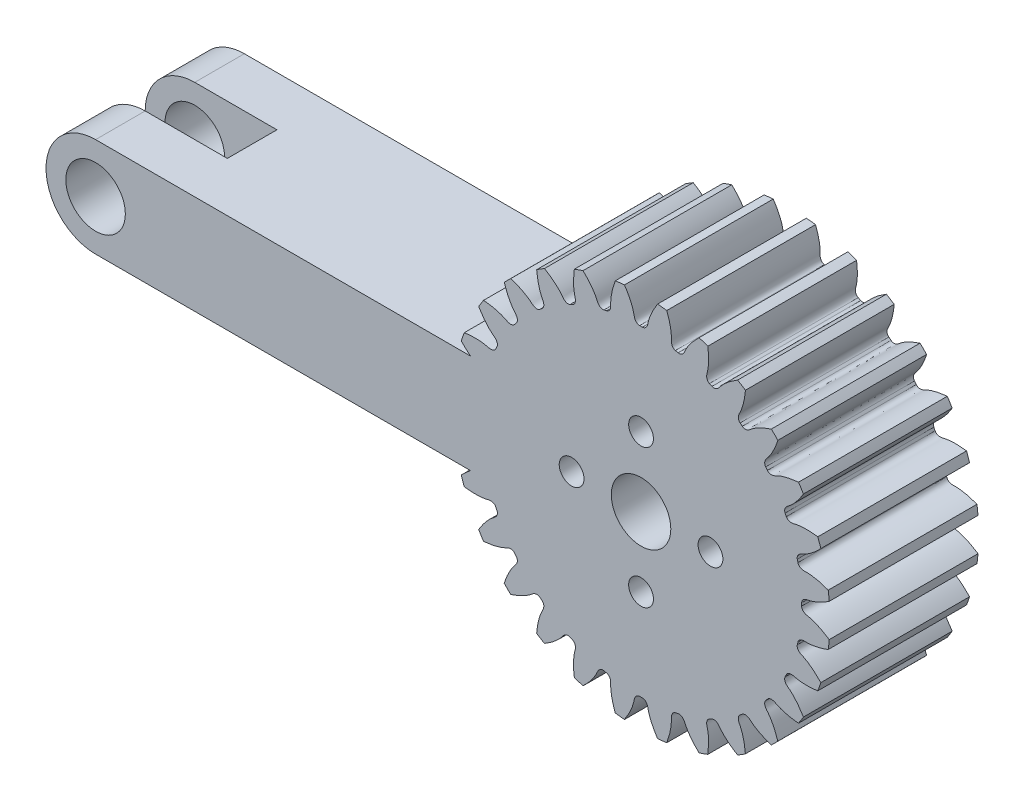
from build123d import *

# Parameters (mm, degrees)
EXTRUDE_1_DEPTH          = 5
EXTRUDE_1_DEPTH_BACK     = 10
SKETCH_1_R               = 3
CUT_EXTRUDE_2_DEPTH      = 64.718993069
CUT_EXTRUDE_2_DEPTH_BACK = 64.718993069
SKETCH_2_R               = 1.25
SKETCH_3_W               = 17.550489661
SKETCH_3_H               = 5
CUT_EXTRUDE_3_DEPTH      = 10


with BuildPart() as part:
    # 草图1 → 凸台-拉伸1 (new, two sides: drawn at the far end of the back side and taken through both)
    with BuildSketch(Plane.XY.offset(-EXTRUDE_1_DEPTH_BACK)):
        with BuildLine():
            Line((-55.000000003, -5), (-17.189672893, -5))
            add(Edge.make_bspline(
                [(-17.189672893, -5), (-17.234816242, -5.034346704), (-17.349749289, -5.124219314), (-17.536191325, -5.279824137), (-17.80860774, -5.524961859), (-18.005037889, -5.720820117), (-18.128938166, -5.851845946)],
                knots=[0.59534025, 0.59534025, 0.59534025, 0.59534025, 0.64525175, 0.723705691, 0.808981712, 0.967654618, 0.967654618, 0.967654618, 0.967654618], degree=3))
            ThreePointArc((-18.128938166, -5.851845946), (-17.980977442, -6.29181613), (-17.822340871, -6.728050674))
            add(Edge.make_bspline(
                [(-17.822340871, -6.728050674), (-17.643778466, -6.753240232), (-17.368087565, -6.783896191), (-17.002262965, -6.805703723), (-16.734795461, -6.811665992), (-16.490552385, -6.808015621), (-16.269846811, -6.796491497), (-16.072892713, -6.778846207), (-15.899810708, -6.756822422), (-15.750610886, -6.732203615), (-15.625244615, -6.706642823), (-15.533531282, -6.684564509), (-15.471344468, -6.667222726), (-15.430523644, -6.656085529), (-15.393629767, -6.647190172), (-15.33380149, -6.634339407), (-15.25072127, -6.621223819), (-15.14258995, -6.61531865), (-15.03017156, -6.623891837), (-14.908326777, -6.655267468), (-14.762390177, -6.733756345), (-14.68161261, -6.832732793), (-14.648805604, -6.899967437)],
                knots=[0.032345382, 0.032345382, 0.032345382, 0.032345382, 0.191018288, 0.276294309, 0.35474825, 0.426380109, 0.491189887, 0.549177584, 0.6003432, 0.644686735, 0.682208189, 0.712907564, 0.727668831, 0.739016053, 0.750138704, 0.761058269, 0.792860949, 0.824037898, 0.856152362, 0.891704777, 0.93402643, 1, 1, 1, 1], degree=3))
            ThreePointArc((-14.648805604, -6.899967437), (-14.588938394, -7.025662446), (-14.527992674, -7.150838071))
            add(Edge.make_bspline(
                [(-14.527992674, -7.150838071), (-14.495881346, -7.218407737), (-14.468862432, -7.343272987), (-14.498487338, -7.50630783), (-14.549925863, -7.621132303), (-14.613314795, -7.714369834), (-14.685350417, -7.795228492), (-14.747404266, -7.852005788), (-14.794753719, -7.890769098), (-14.824711346, -7.914067728), (-14.858870125, -7.939038805), (-14.911201321, -7.976845988), (-14.98564517, -8.034784756), (-15.083793993, -8.116863161), (-15.196066319, -8.218162704), (-15.321200072, -8.33975206), (-15.457794587, -8.482735315), (-15.604412185, -8.648104708), (-15.759549226, -8.836785664), (-15.921650998, -9.049617594), (-16.13268909, -9.349227556), (-16.280611762, -9.58388506), (-16.372249611, -9.739196203)],
                knots=[0, 0, 0, 0, 0.06597357, 0.108295223, 0.143847638, 0.175962102, 0.207139051, 0.238941731, 0.249861296, 0.260983947, 0.272331169, 0.287092436, 0.317791811, 0.355313265, 0.3996568, 0.450822416, 0.508810113, 0.573619891, 0.64525175, 0.723705691, 0.808981712, 0.967654618, 0.967654618, 0.967654618, 0.967654618], degree=3))
            ThreePointArc((-16.372249611, -9.739196203), (-16.130095995, -10.135211058), (-15.878365456, -10.525208332))
            add(Edge.make_bspline(
                [(-15.878365456, -10.525208332), (-15.698674779, -10.510032463), (-15.423074432, -10.478572816), (-15.061569186, -10.418429956), (-14.799480921, -10.364725619), (-14.562173813, -10.306817573), (-14.349566148, -10.246470773), (-14.161476547, -10.185441477), (-13.997634822, -10.125455505), (-13.85765395, -10.068253859), (-13.741118685, -10.01543731), (-13.656617684, -9.973504409), (-13.599848933, -9.942759553), (-13.562529832, -9.922818101), (-13.528540364, -9.905936109), (-13.473071671, -9.880094495), (-13.394992938, -9.848820654), (-13.290886721, -9.819002059), (-13.17937918, -9.802344852), (-13.053607566, -9.805820815), (-12.893864483, -9.849867864), (-12.793087847, -9.928388067), (-12.746142265, -9.986636752)],
                knots=[0.032345382, 0.032345382, 0.032345382, 0.032345382, 0.191018288, 0.276294309, 0.35474825, 0.426380109, 0.491189887, 0.549177584, 0.6003432, 0.644686735, 0.682208189, 0.712907564, 0.727668831, 0.739016053, 0.750138704, 0.761058269, 0.792860949, 0.824037898, 0.856152362, 0.891704777, 0.93402643, 1, 1, 1, 1], degree=3))
            ThreePointArc((-12.746142265, -9.986636752), (-12.65980628, -10.095858617), (-12.572534399, -10.20433413))
            add(Edge.make_bspline(
                [(-12.572534399, -10.20433413), (-12.526192505, -10.26306424), (-12.472065879, -10.378786584), (-12.464669362, -10.544325964), (-12.489267366, -10.667717697), (-12.530319703, -10.772722933), (-12.582556497, -10.867583729), (-12.63042039, -10.936745781), (-12.667957046, -10.985073457), (-12.691979139, -11.014454141), (-12.719724898, -11.046400184), (-12.762331153, -11.09490425), (-12.82201595, -11.167955686), (-12.899439814, -11.269816382), (-12.986355969, -11.393559077), (-13.081296181, -11.539944813), (-13.182649219, -11.709738319), (-13.288792655, -11.90358704), (-13.398054625, -12.122058611), (-13.508732607, -12.365625437), (-13.647810045, -12.704683946), (-13.73980778, -12.966373987), (-13.794588096, -13.138182495)],
                knots=[0, 0, 0, 0, 0.06597357, 0.108295223, 0.143847638, 0.175962102, 0.207139051, 0.238941731, 0.249861296, 0.260983947, 0.272331169, 0.287092436, 0.317791811, 0.355313265, 0.3996568, 0.450822416, 0.508810113, 0.573619891, 0.64525175, 0.723705691, 0.808981712, 0.967654618, 0.967654618, 0.967654618, 0.967654618], degree=3))
            ThreePointArc((-13.794588096, -13.138182495), (-13.470384182, -13.470384182), (-13.138182495, -13.794588096))
            add(Edge.make_bspline(
                [(-13.138182495, -13.794588096), (-12.966373987, -13.73980778), (-12.704683946, -13.647810045), (-12.365625437, -13.508732607), (-12.122058611, -13.398054625), (-11.90358704, -13.288792655), (-11.709738319, -13.182649219), (-11.539944813, -13.081296181), (-11.393559077, -12.986355969), (-11.269816382, -12.899439814), (-11.167955686, -12.82201595), (-11.09490425, -12.762331153), (-11.046400184, -12.719724898), (-11.014454141, -12.691979139), (-10.985073458, -12.667957046), (-10.936745781, -12.63042039), (-10.867583729, -12.582556497), (-10.772722933, -12.530319703), (-10.667717697, -12.489267366), (-10.544325964, -12.464669362), (-10.378786584, -12.472065879), (-10.26306424, -12.526192505), (-10.20433413, -12.572534399)],
                knots=[0.032345382, 0.032345382, 0.032345382, 0.032345382, 0.191018288, 0.276294309, 0.35474825, 0.426380109, 0.491189887, 0.549177584, 0.6003432, 0.644686735, 0.682208189, 0.712907564, 0.727668831, 0.739016053, 0.750138704, 0.761058269, 0.792860949, 0.824037898, 0.856152362, 0.891704777, 0.93402643, 1, 1, 1, 1], degree=3))
            ThreePointArc((-10.20433413, -12.572534399), (-10.095858617, -12.65980628), (-9.986636752, -12.746142265))
            add(Edge.make_bspline(
                [(-9.986636752, -12.746142265), (-9.928388067, -12.793087847), (-9.849867864, -12.893864483), (-9.805820815, -13.053607566), (-9.802344852, -13.17937918), (-9.819002059, -13.290886721), (-9.848820654, -13.394992938), (-9.880094495, -13.473071671), (-9.905936109, -13.528540364), (-9.922818101, -13.562529831), (-9.942759553, -13.599848933), (-9.973504409, -13.656617684), (-10.01543731, -13.741118685), (-10.068253859, -13.85765395), (-10.125455505, -13.997634822), (-10.185441477, -14.161476547), (-10.246470773, -14.349566148), (-10.306817573, -14.562173813), (-10.364725619, -14.799480921), (-10.418429956, -15.061569186), (-10.478572816, -15.423074432), (-10.510032463, -15.698674779), (-10.525208332, -15.878365456)],
                knots=[0, 0, 0, 0, 0.06597357, 0.108295223, 0.143847638, 0.175962102, 0.207139051, 0.238941731, 0.249861296, 0.260983947, 0.272331169, 0.287092436, 0.317791811, 0.355313265, 0.3996568, 0.450822416, 0.508810113, 0.573619891, 0.64525175, 0.723705691, 0.808981712, 0.967654618, 0.967654618, 0.967654618, 0.967654618], degree=3))
            ThreePointArc((-10.525208332, -15.878365456), (-10.135211058, -16.130095995), (-9.739196203, -16.372249611))
            add(Edge.make_bspline(
                [(-9.739196203, -16.372249611), (-9.58388506, -16.280611762), (-9.349227556, -16.13268909), (-9.049617594, -15.921650998), (-8.836785664, -15.759549226), (-8.648104708, -15.604412185), (-8.482735315, -15.457794587), (-8.33975206, -15.321200072), (-8.218162704, -15.196066319), (-8.116863161, -15.083793993), (-8.034784756, -14.98564517), (-7.976845988, -14.911201321), (-7.939038805, -14.858870125), (-7.914067728, -14.824711346), (-7.890769098, -14.794753719), (-7.852005788, -14.747404266), (-7.795228492, -14.685350417), (-7.714369834, -14.613314795), (-7.621132303, -14.549925862), (-7.50630783, -14.498487338), (-7.343272987, -14.468862432), (-7.218407737, -14.495881346), (-7.150838072, -14.527992674)],
                knots=[0.032345382, 0.032345382, 0.032345382, 0.032345382, 0.191018288, 0.276294309, 0.35474825, 0.426380109, 0.491189887, 0.549177584, 0.6003432, 0.644686735, 0.682208189, 0.712907564, 0.727668831, 0.739016053, 0.750138704, 0.761058269, 0.792860949, 0.824037898, 0.856152362, 0.891704777, 0.93402643, 1, 1, 1, 1], degree=3))
            ThreePointArc((-7.150838072, -14.527992674), (-7.025662446, -14.588938394), (-6.899967437, -14.648805604))
            add(Edge.make_bspline(
                [(-6.899967437, -14.648805604), (-6.832732793, -14.68161261), (-6.733756345, -14.762390177), (-6.655267468, -14.908326777), (-6.623891837, -15.03017156), (-6.61531865, -15.14258995), (-6.621223819, -15.25072127), (-6.634339407, -15.33380149), (-6.647190172, -15.393629767), (-6.656085529, -15.430523644), (-6.667222726, -15.471344468), (-6.684564509, -15.533531282), (-6.706642823, -15.625244615), (-6.732203615, -15.750610886), (-6.756822422, -15.899810708), (-6.778846207, -16.072892713), (-6.796491497, -16.269846811), (-6.808015621, -16.490552385), (-6.811665992, -16.734795461), (-6.805703723, -17.002262965), (-6.783896191, -17.368087565), (-6.753240232, -17.643778466), (-6.728050674, -17.822340871)],
                knots=[0, 0, 0, 0, 0.06597357, 0.108295223, 0.143847638, 0.175962102, 0.207139051, 0.238941731, 0.249861296, 0.260983947, 0.272331169, 0.287092436, 0.317791811, 0.355313265, 0.3996568, 0.450822416, 0.508810113, 0.573619891, 0.64525175, 0.723705691, 0.808981712, 0.967654618, 0.967654618, 0.967654618, 0.967654618], degree=3))
            ThreePointArc((-6.728050674, -17.822340871), (-6.29181613, -17.980977442), (-5.851845946, -18.128938166))
            add(Edge.make_bspline(
                [(-5.851845946, -18.128938166), (-5.720820117, -18.005037889), (-5.524961859, -17.80860774), (-5.279824137, -17.536191325), (-5.108399385, -17.330794223), (-4.958970294, -17.137561328), (-4.830372542, -16.957821588), (-4.721369314, -16.792835016), (-4.630673337, -16.64378245), (-4.556896528, -16.511783756), (-4.498716168, -16.397831566), (-4.458795361, -16.312361591), (-4.433580869, -16.252929557), (-4.416836913, -16.214070623), (-4.400788627, -16.179679664), (-4.373533439, -16.124891713), (-4.331987949, -16.051759546), (-4.26918602, -15.963537264), (-4.192391513, -15.880990321), (-4.091892077, -15.80529062), (-3.93953702, -15.740129806), (-3.811790128, -15.738686168), (-3.738769133, -15.754956732)],
                knots=[0.032345382, 0.032345382, 0.032345382, 0.032345382, 0.191018288, 0.276294309, 0.35474825, 0.426380109, 0.491189887, 0.549177584, 0.6003432, 0.644686735, 0.682208189, 0.712907564, 0.727668831, 0.739016053, 0.750138704, 0.761058269, 0.792860949, 0.824037898, 0.856152362, 0.891704777, 0.93402643, 1, 1, 1, 1], degree=3))
            ThreePointArc((-3.738769133, -15.754956732), (-3.603170223, -15.786520218), (-3.467304943, -15.816916662))
            add(Edge.make_bspline(
                [(-3.467304943, -15.816916662), (-3.394455767, -15.833940012), (-3.279986165, -15.890667985), (-3.170991219, -16.015480231), (-3.113289227, -16.127288376), (-3.079915542, -16.23498049), (-3.061611173, -16.341714755), (-3.055910838, -16.425630473), (-3.055126363, -16.486818295), (-3.055589036, -16.524766568), (-3.057363512, -16.567042188), (-3.060432633, -16.631528759), (-3.06154926, -16.725855534), (-3.05857257, -16.853766422), (-3.049374048, -17.004703694), (-3.032331281, -17.178346925), (-3.005707757, -17.374289419), (-2.967831337, -17.592025802), (-2.917040988, -17.830957477), (-2.851711087, -18.090392283), (-2.749046684, -18.442192264), (-2.657812337, -18.704149427), (-2.59352046, -18.872629695)],
                knots=[0, 0, 0, 0, 0.06597357, 0.108295223, 0.143847638, 0.175962102, 0.207139051, 0.238941731, 0.249861296, 0.260983947, 0.272331169, 0.287092436, 0.317791811, 0.355313265, 0.3996568, 0.450822416, 0.508810113, 0.573619891, 0.64525175, 0.723705691, 0.808981712, 0.967654618, 0.967654618, 0.967654618, 0.967654618], degree=3))
            ThreePointArc((-2.59352046, -18.872629695), (-2.13292327, -18.930217598), (-1.671059698, -18.976566061))
            add(Edge.make_bspline(
                [(-1.671059698, -18.976566061), (-1.570889366, -18.826616233), (-1.423651503, -18.591528436), (-1.245278251, -18.271393794), (-1.123856631, -18.033000831), (-1.021172403, -17.811361587), (-0.93579472, -17.607512606), (-0.866237397, -17.422407091), (-0.810982674, -17.25690983), (-0.768428075, -17.111803735), (-0.737063166, -16.987762216), (-0.717162116, -16.895551937), (-0.705804675, -16.831999236), (-0.698127451, -16.790388696), (-0.690134238, -16.75328891), (-0.675753861, -16.693809757), (-0.651523441, -16.613266425), (-0.609927392, -16.513281316), (-0.553426706, -16.415715612), (-0.47229177, -16.319550632), (-0.338256217, -16.222121346), (-0.214033446, -16.192287545), (-0.139222699, -16.191901472)],
                knots=[0.032345382, 0.032345382, 0.032345382, 0.032345382, 0.191018288, 0.276294309, 0.35474825, 0.426380109, 0.491189887, 0.549177584, 0.6003432, 0.644686735, 0.682208189, 0.712907564, 0.727668831, 0.739016053, 0.750138704, 0.761058269, 0.792860949, 0.824037898, 0.856152362, 0.891704777, 0.93402643, 1, 1, 1, 1], degree=3))
            ThreePointArc((-0.139222699, -16.191901472), (0, -16.1925), (0.139222699, -16.191901472))
            add(Edge.make_bspline(
                [(0.139222699, -16.191901472), (0.214033446, -16.192287545), (0.338256217, -16.222121346), (0.47229177, -16.319550632), (0.553426706, -16.415715612), (0.609927392, -16.513281316), (0.651523441, -16.613266425), (0.675753861, -16.693809757), (0.690134238, -16.75328891), (0.698127451, -16.790388696), (0.705804675, -16.831999236), (0.717162116, -16.895551937), (0.737063166, -16.987762216), (0.768428075, -17.111803735), (0.810982673, -17.25690983), (0.866237396, -17.422407091), (0.93579472, -17.607512606), (1.021172403, -17.811361587), (1.123856631, -18.033000831), (1.24527825, -18.271393794), (1.423651503, -18.591528436), (1.570889366, -18.826616233), (1.671059698, -18.976566061)],
                knots=[0, 0, 0, 0, 0.06597357, 0.108295223, 0.143847638, 0.175962102, 0.207139051, 0.238941731, 0.249861296, 0.260983947, 0.272331169, 0.287092436, 0.317791811, 0.355313265, 0.3996568, 0.450822416, 0.508810113, 0.573619891, 0.64525175, 0.723705691, 0.808981712, 0.967654618, 0.967654618, 0.967654618, 0.967654618], degree=3))
            ThreePointArc((1.671059698, -18.976566061), (2.13292327, -18.930217598), (2.59352046, -18.872629695))
            add(Edge.make_bspline(
                [(2.59352046, -18.872629695), (2.657812337, -18.704149427), (2.749046684, -18.442192264), (2.851711087, -18.090392283), (2.917040988, -17.830957477), (2.967831337, -17.592025802), (3.005707757, -17.374289419), (3.032331281, -17.178346925), (3.049374048, -17.004703694), (3.05857257, -16.853766422), (3.06154926, -16.725855534), (3.060432632, -16.631528759), (3.057363512, -16.567042188), (3.055589035, -16.524766568), (3.055126363, -16.486818295), (3.055910838, -16.425630473), (3.061611173, -16.341714755), (3.079915542, -16.23498049), (3.113289227, -16.127288376), (3.170991219, -16.015480231), (3.279986165, -15.890667985), (3.394455767, -15.833940012), (3.467304943, -15.816916662)],
                knots=[0.032345382, 0.032345382, 0.032345382, 0.032345382, 0.191018288, 0.276294309, 0.35474825, 0.426380109, 0.491189887, 0.549177584, 0.6003432, 0.644686735, 0.682208189, 0.712907564, 0.727668831, 0.739016053, 0.750138704, 0.761058269, 0.792860949, 0.824037898, 0.856152362, 0.891704777, 0.93402643, 1, 1, 1, 1], degree=3))
            ThreePointArc((3.467304943, -15.816916662), (3.603170223, -15.786520218), (3.738769133, -15.754956732))
            add(Edge.make_bspline(
                [(3.738769133, -15.754956732), (3.811790128, -15.738686168), (3.93953702, -15.740129806), (4.091892077, -15.80529062), (4.192391513, -15.880990321), (4.26918602, -15.963537264), (4.331987949, -16.051759546), (4.373533439, -16.124891713), (4.400788627, -16.179679664), (4.416836913, -16.214070623), (4.433580869, -16.252929557), (4.458795361, -16.312361591), (4.498716168, -16.397831566), (4.556896528, -16.511783756), (4.630673337, -16.64378245), (4.721369314, -16.792835016), (4.830372542, -16.957821588), (4.958970294, -17.137561328), (5.108399385, -17.330794223), (5.279824137, -17.536191325), (5.524961859, -17.80860774), (5.720820117, -18.005037889), (5.851845946, -18.128938166)],
                knots=[0, 0, 0, 0, 0.06597357, 0.108295223, 0.143847638, 0.175962102, 0.207139051, 0.238941731, 0.249861296, 0.260983947, 0.272331169, 0.287092436, 0.317791811, 0.355313265, 0.3996568, 0.450822416, 0.508810113, 0.573619891, 0.64525175, 0.723705691, 0.808981712, 0.967654618, 0.967654618, 0.967654618, 0.967654618], degree=3))
            ThreePointArc((5.851845946, -18.128938166), (6.29181613, -17.980977442), (6.728050674, -17.822340871))
            add(Edge.make_bspline(
                [(6.728050674, -17.822340871), (6.753240232, -17.643778466), (6.783896191, -17.368087565), (6.805703723, -17.002262965), (6.811665992, -16.734795461), (6.808015621, -16.490552385), (6.796491497, -16.269846811), (6.778846207, -16.072892713), (6.756822422, -15.899810708), (6.732203615, -15.750610886), (6.706642823, -15.625244615), (6.684564509, -15.533531282), (6.667222726, -15.471344468), (6.656085529, -15.430523644), (6.647190172, -15.393629767), (6.634339407, -15.33380149), (6.621223819, -15.25072127), (6.61531865, -15.14258995), (6.623891837, -15.03017156), (6.655267468, -14.908326777), (6.733756345, -14.762390177), (6.832732793, -14.68161261), (6.899967437, -14.648805604)],
                knots=[0.032345382, 0.032345382, 0.032345382, 0.032345382, 0.191018288, 0.276294309, 0.35474825, 0.426380109, 0.491189887, 0.549177584, 0.6003432, 0.644686735, 0.682208189, 0.712907564, 0.727668831, 0.739016053, 0.750138704, 0.761058269, 0.792860949, 0.824037898, 0.856152362, 0.891704777, 0.93402643, 1, 1, 1, 1], degree=3))
            ThreePointArc((6.899967437, -14.648805604), (7.025662446, -14.588938394), (7.150838071, -14.527992674))
            add(Edge.make_bspline(
                [(7.150838071, -14.527992674), (7.218407737, -14.495881346), (7.343272987, -14.468862432), (7.50630783, -14.498487338), (7.621132303, -14.549925862), (7.714369834, -14.613314795), (7.795228492, -14.685350417), (7.852005788, -14.747404266), (7.890769098, -14.794753719), (7.914067728, -14.824711346), (7.939038804, -14.858870125), (7.976845988, -14.911201321), (8.034784756, -14.98564517), (8.116863161, -15.083793993), (8.218162704, -15.196066319), (8.33975206, -15.321200072), (8.482735315, -15.457794587), (8.648104708, -15.604412185), (8.836785664, -15.759549226), (9.049617594, -15.921650998), (9.349227556, -16.13268909), (9.58388506, -16.280611762), (9.739196203, -16.372249611)],
                knots=[0, 0, 0, 0, 0.06597357, 0.108295223, 0.143847638, 0.175962102, 0.207139051, 0.238941731, 0.249861296, 0.260983947, 0.272331169, 0.287092436, 0.317791811, 0.355313265, 0.3996568, 0.450822416, 0.508810113, 0.573619891, 0.64525175, 0.723705691, 0.808981712, 0.967654618, 0.967654618, 0.967654618, 0.967654618], degree=3))
            ThreePointArc((9.739196203, -16.372249611), (10.135211058, -16.130095995), (10.525208332, -15.878365456))
            add(Edge.make_bspline(
                [(10.525208332, -15.878365456), (10.510032463, -15.698674779), (10.478572816, -15.423074432), (10.418429956, -15.061569186), (10.364725619, -14.799480921), (10.306817573, -14.562173813), (10.246470773, -14.349566148), (10.185441477, -14.161476547), (10.125455505, -13.997634822), (10.068253859, -13.85765395), (10.01543731, -13.741118685), (9.973504409, -13.656617684), (9.942759553, -13.599848933), (9.922818101, -13.562529831), (9.905936109, -13.528540364), (9.880094495, -13.473071671), (9.848820654, -13.394992938), (9.819002059, -13.290886721), (9.802344852, -13.17937918), (9.805820815, -13.053607566), (9.849867864, -12.893864483), (9.928388067, -12.793087847), (9.986636752, -12.746142265)],
                knots=[0.032345382, 0.032345382, 0.032345382, 0.032345382, 0.191018288, 0.276294309, 0.35474825, 0.426380109, 0.491189887, 0.549177584, 0.6003432, 0.644686735, 0.682208189, 0.712907564, 0.727668831, 0.739016053, 0.750138704, 0.761058269, 0.792860949, 0.824037898, 0.856152362, 0.891704777, 0.93402643, 1, 1, 1, 1], degree=3))
            ThreePointArc((9.986636752, -12.746142265), (10.095858617, -12.65980628), (10.20433413, -12.572534399))
            add(Edge.make_bspline(
                [(10.20433413, -12.572534399), (10.26306424, -12.526192505), (10.378786583, -12.472065879), (10.544325964, -12.464669362), (10.667717696, -12.489267366), (10.772722933, -12.530319703), (10.867583729, -12.582556497), (10.936745781, -12.63042039), (10.985073457, -12.667957046), (11.014454141, -12.691979139), (11.046400184, -12.719724898), (11.09490425, -12.762331153), (11.167955686, -12.82201595), (11.269816382, -12.899439814), (11.393559077, -12.986355969), (11.539944813, -13.081296181), (11.709738319, -13.182649219), (11.90358704, -13.288792655), (12.122058611, -13.398054625), (12.365625437, -13.508732607), (12.704683946, -13.647810045), (12.966373987, -13.73980778), (13.138182495, -13.794588096)],
                knots=[0, 0, 0, 0, 0.06597357, 0.108295223, 0.143847638, 0.175962102, 0.207139051, 0.238941731, 0.249861296, 0.260983947, 0.272331169, 0.287092436, 0.317791811, 0.355313265, 0.3996568, 0.450822416, 0.508810113, 0.573619891, 0.64525175, 0.723705691, 0.808981712, 0.967654618, 0.967654618, 0.967654618, 0.967654618], degree=3))
            ThreePointArc((13.138182495, -13.794588096), (13.470384182, -13.470384182), (13.794588096, -13.138182495))
            add(Edge.make_bspline(
                [(13.794588096, -13.138182495), (13.73980778, -12.966373987), (13.647810045, -12.704683946), (13.508732607, -12.365625437), (13.398054625, -12.122058611), (13.288792655, -11.90358704), (13.182649219, -11.709738319), (13.081296181, -11.539944813), (12.986355969, -11.393559077), (12.899439814, -11.269816382), (12.82201595, -11.167955686), (12.762331153, -11.09490425), (12.719724898, -11.046400184), (12.691979139, -11.014454141), (12.667957046, -10.985073457), (12.63042039, -10.936745781), (12.582556497, -10.867583729), (12.530319703, -10.772722933), (12.489267366, -10.667717697), (12.464669362, -10.544325964), (12.472065879, -10.378786584), (12.526192505, -10.26306424), (12.572534399, -10.20433413)],
                knots=[0.032345382, 0.032345382, 0.032345382, 0.032345382, 0.191018288, 0.276294309, 0.35474825, 0.426380109, 0.491189887, 0.549177584, 0.6003432, 0.644686735, 0.682208189, 0.712907564, 0.727668831, 0.739016053, 0.750138704, 0.761058269, 0.792860949, 0.824037898, 0.856152362, 0.891704777, 0.93402643, 1, 1, 1, 1], degree=3))
            ThreePointArc((12.572534399, -10.20433413), (12.65980628, -10.095858617), (12.746142265, -9.986636752))
            add(Edge.make_bspline(
                [(12.746142265, -9.986636752), (12.793087847, -9.928388067), (12.893864483, -9.849867864), (13.053607566, -9.805820815), (13.17937918, -9.802344852), (13.29088672, -9.819002059), (13.394992938, -9.848820654), (13.473071671, -9.880094495), (13.528540364, -9.905936109), (13.562529831, -9.922818101), (13.599848933, -9.942759553), (13.656617683, -9.973504409), (13.741118685, -10.01543731), (13.85765395, -10.068253859), (13.997634822, -10.125455505), (14.161476547, -10.185441477), (14.349566148, -10.246470773), (14.562173813, -10.306817573), (14.799480921, -10.364725619), (15.061569186, -10.418429956), (15.423074432, -10.478572816), (15.698674779, -10.510032463), (15.878365456, -10.525208332)],
                knots=[0, 0, 0, 0, 0.06597357, 0.108295223, 0.143847638, 0.175962102, 0.207139051, 0.238941731, 0.249861296, 0.260983947, 0.272331169, 0.287092436, 0.317791811, 0.355313265, 0.3996568, 0.450822416, 0.508810113, 0.573619891, 0.64525175, 0.723705691, 0.808981712, 0.967654618, 0.967654618, 0.967654618, 0.967654618], degree=3))
            ThreePointArc((15.878365456, -10.525208332), (16.130095995, -10.135211058), (16.372249611, -9.739196203))
            add(Edge.make_bspline(
                [(16.372249611, -9.739196203), (16.280611762, -9.58388506), (16.13268909, -9.349227556), (15.921650998, -9.049617594), (15.759549226, -8.836785664), (15.604412185, -8.648104708), (15.457794587, -8.482735315), (15.321200072, -8.33975206), (15.196066319, -8.218162704), (15.083793993, -8.116863161), (14.98564517, -8.034784756), (14.911201321, -7.976845988), (14.858870125, -7.939038805), (14.824711346, -7.914067728), (14.794753719, -7.890769098), (14.747404266, -7.852005788), (14.685350417, -7.795228492), (14.613314795, -7.714369834), (14.549925862, -7.621132303), (14.498487338, -7.50630783), (14.468862432, -7.343272987), (14.495881346, -7.218407737), (14.527992674, -7.150838072)],
                knots=[0.032345382, 0.032345382, 0.032345382, 0.032345382, 0.191018288, 0.276294309, 0.35474825, 0.426380109, 0.491189887, 0.549177584, 0.6003432, 0.644686735, 0.682208189, 0.712907564, 0.727668831, 0.739016053, 0.750138704, 0.761058269, 0.792860949, 0.824037898, 0.856152362, 0.891704777, 0.93402643, 1, 1, 1, 1], degree=3))
            ThreePointArc((14.527992674, -7.150838072), (14.588938393, -7.025662446), (14.648805604, -6.899967437))
            add(Edge.make_bspline(
                [(14.648805604, -6.899967437), (14.68161261, -6.832732793), (14.762390177, -6.733756345), (14.908326777, -6.655267468), (15.03017156, -6.623891837), (15.14258995, -6.61531865), (15.25072127, -6.621223819), (15.33380149, -6.634339407), (15.393629767, -6.647190172), (15.430523644, -6.656085529), (15.471344468, -6.667222726), (15.533531282, -6.684564509), (15.625244615, -6.706642823), (15.750610886, -6.732203615), (15.899810708, -6.756822422), (16.072892713, -6.778846207), (16.269846811, -6.796491497), (16.490552385, -6.808015621), (16.734795461, -6.811665992), (17.002262965, -6.805703723), (17.368087565, -6.783896191), (17.643778466, -6.753240232), (17.822340871, -6.728050674)],
                knots=[0, 0, 0, 0, 0.06597357, 0.108295223, 0.143847638, 0.175962102, 0.207139051, 0.238941731, 0.249861296, 0.260983947, 0.272331169, 0.287092436, 0.317791811, 0.355313265, 0.3996568, 0.450822416, 0.508810113, 0.573619891, 0.64525175, 0.723705691, 0.808981712, 0.967654618, 0.967654618, 0.967654618, 0.967654618], degree=3))
            ThreePointArc((17.822340871, -6.728050674), (17.980977442, -6.29181613), (18.128938166, -5.851845946))
            add(Edge.make_bspline(
                [(18.128938166, -5.851845946), (18.005037889, -5.720820117), (17.80860774, -5.524961859), (17.536191325, -5.279824137), (17.330794223, -5.108399385), (17.137561328, -4.958970294), (16.957821588, -4.830372542), (16.792835016, -4.721369314), (16.64378245, -4.630673337), (16.511783756, -4.556896528), (16.397831566, -4.498716168), (16.312361591, -4.458795361), (16.252929557, -4.433580869), (16.214070623, -4.416836913), (16.179679664, -4.400788627), (16.124891713, -4.373533439), (16.051759546, -4.331987949), (15.963537264, -4.26918602), (15.880990321, -4.192391513), (15.80529062, -4.091892077), (15.740129806, -3.93953702), (15.738686168, -3.811790128), (15.754956732, -3.738769133)],
                knots=[0.032345382, 0.032345382, 0.032345382, 0.032345382, 0.191018288, 0.276294309, 0.35474825, 0.426380109, 0.491189887, 0.549177584, 0.6003432, 0.644686735, 0.682208189, 0.712907564, 0.727668831, 0.739016053, 0.750138704, 0.761058269, 0.792860949, 0.824037898, 0.856152362, 0.891704777, 0.93402643, 1, 1, 1, 1], degree=3))
            ThreePointArc((15.754956732, -3.738769133), (15.786520218, -3.603170223), (15.816916662, -3.467304943))
            add(Edge.make_bspline(
                [(15.816916662, -3.467304943), (15.833940012, -3.394455767), (15.890667985, -3.279986165), (16.015480231, -3.170991219), (16.127288376, -3.113289227), (16.23498049, -3.079915542), (16.341714755, -3.061611173), (16.425630473, -3.055910838), (16.486818295, -3.055126363), (16.524766568, -3.055589036), (16.567042188, -3.057363512), (16.631528759, -3.060432632), (16.725855534, -3.06154926), (16.853766422, -3.05857257), (17.004703694, -3.049374048), (17.178346925, -3.032331281), (17.374289419, -3.005707757), (17.592025802, -2.967831337), (17.830957477, -2.917040988), (18.090392283, -2.851711087), (18.442192264, -2.749046684), (18.704149427, -2.657812337), (18.872629695, -2.59352046)],
                knots=[0, 0, 0, 0, 0.06597357, 0.108295223, 0.143847638, 0.175962102, 0.207139051, 0.238941731, 0.249861296, 0.260983947, 0.272331169, 0.287092436, 0.317791811, 0.355313265, 0.3996568, 0.450822416, 0.508810113, 0.573619891, 0.64525175, 0.723705691, 0.808981712, 0.967654618, 0.967654618, 0.967654618, 0.967654618], degree=3))
            ThreePointArc((18.872629695, -2.59352046), (18.930217598, -2.13292327), (18.976566061, -1.671059698))
            add(Edge.make_bspline(
                [(18.976566061, -1.671059698), (18.826616233, -1.570889366), (18.591528436, -1.423651503), (18.271393794, -1.245278251), (18.033000831, -1.123856631), (17.811361587, -1.021172403), (17.607512606, -0.93579472), (17.422407091, -0.866237396), (17.25690983, -0.810982673), (17.111803735, -0.768428075), (16.987762216, -0.737063166), (16.895551937, -0.717162116), (16.831999236, -0.705804675), (16.790388696, -0.698127451), (16.75328891, -0.690134238), (16.693809757, -0.675753861), (16.613266425, -0.651523441), (16.513281316, -0.609927392), (16.415715612, -0.553426706), (16.319550632, -0.47229177), (16.222121346, -0.338256217), (16.192287545, -0.214033446), (16.191901472, -0.139222699)],
                knots=[0.032345382, 0.032345382, 0.032345382, 0.032345382, 0.191018288, 0.276294309, 0.35474825, 0.426380109, 0.491189887, 0.549177584, 0.6003432, 0.644686735, 0.682208189, 0.712907564, 0.727668831, 0.739016053, 0.750138704, 0.761058269, 0.792860949, 0.824037898, 0.856152362, 0.891704777, 0.93402643, 1, 1, 1, 1], degree=3))
            ThreePointArc((16.191901472, -0.139222699), (16.1925, 0), (16.191901472, 0.139222699))
            add(Edge.make_bspline(
                [(16.191901472, 0.139222699), (16.192287545, 0.214033446), (16.222121346, 0.338256217), (16.319550632, 0.47229177), (16.415715612, 0.553426706), (16.513281316, 0.609927392), (16.613266425, 0.651523441), (16.693809757, 0.675753861), (16.75328891, 0.690134238), (16.790388696, 0.698127451), (16.831999236, 0.705804675), (16.895551937, 0.717162116), (16.987762216, 0.737063166), (17.111803735, 0.768428075), (17.25690983, 0.810982673), (17.422407091, 0.866237396), (17.607512606, 0.93579472), (17.811361587, 1.021172403), (18.033000831, 1.123856631), (18.271393794, 1.245278251), (18.591528436, 1.423651503), (18.826616233, 1.570889366), (18.976566061, 1.671059698)],
                knots=[0, 0, 0, 0, 0.06597357, 0.108295223, 0.143847638, 0.175962102, 0.207139051, 0.238941731, 0.249861296, 0.260983947, 0.272331169, 0.287092436, 0.317791811, 0.355313265, 0.3996568, 0.450822416, 0.508810113, 0.573619891, 0.64525175, 0.723705691, 0.808981712, 0.967654618, 0.967654618, 0.967654618, 0.967654618], degree=3))
            ThreePointArc((18.976566061, 1.671059698), (18.930217598, 2.13292327), (18.872629695, 2.59352046))
            add(Edge.make_bspline(
                [(18.872629695, 2.59352046), (18.704149427, 2.657812337), (18.442192264, 2.749046684), (18.090392283, 2.851711087), (17.830957477, 2.917040988), (17.592025802, 2.967831337), (17.374289419, 3.005707757), (17.178346925, 3.032331281), (17.004703694, 3.049374048), (16.853766422, 3.05857257), (16.725855534, 3.06154926), (16.631528759, 3.060432632), (16.567042188, 3.057363512), (16.524766568, 3.055589036), (16.486818295, 3.055126363), (16.425630473, 3.055910838), (16.341714755, 3.061611173), (16.23498049, 3.079915542), (16.127288376, 3.113289227), (16.015480231, 3.170991219), (15.890667985, 3.279986165), (15.833940012, 3.394455767), (15.816916662, 3.467304943)],
                knots=[0.032345382, 0.032345382, 0.032345382, 0.032345382, 0.191018288, 0.276294309, 0.35474825, 0.426380109, 0.491189887, 0.549177584, 0.6003432, 0.644686735, 0.682208189, 0.712907564, 0.727668831, 0.739016053, 0.750138704, 0.761058269, 0.792860949, 0.824037898, 0.856152362, 0.891704777, 0.93402643, 1, 1, 1, 1], degree=3))
            ThreePointArc((15.816916662, 3.467304943), (15.786520218, 3.603170223), (15.754956732, 3.738769133))
            add(Edge.make_bspline(
                [(15.754956732, 3.738769133), (15.738686168, 3.811790128), (15.740129806, 3.93953702), (15.80529062, 4.091892077), (15.880990321, 4.192391513), (15.963537264, 4.26918602), (16.051759546, 4.331987949), (16.124891713, 4.373533439), (16.179679664, 4.400788627), (16.214070623, 4.416836913), (16.252929557, 4.433580869), (16.312361591, 4.458795361), (16.397831566, 4.498716168), (16.511783756, 4.556896528), (16.64378245, 4.630673337), (16.792835016, 4.721369314), (16.957821588, 4.830372542), (17.137561328, 4.958970294), (17.330794223, 5.108399385), (17.536191325, 5.279824137), (17.80860774, 5.524961859), (18.005037889, 5.720820117), (18.128938166, 5.851845946)],
                knots=[0, 0, 0, 0, 0.06597357, 0.108295223, 0.143847638, 0.175962102, 0.207139051, 0.238941731, 0.249861296, 0.260983947, 0.272331169, 0.287092436, 0.317791811, 0.355313265, 0.3996568, 0.450822416, 0.508810113, 0.573619891, 0.64525175, 0.723705691, 0.808981712, 0.967654618, 0.967654618, 0.967654618, 0.967654618], degree=3))
            ThreePointArc((18.128938166, 5.851845946), (17.980977442, 6.29181613), (17.822340871, 6.728050674))
            add(Edge.make_bspline(
                [(17.822340871, 6.728050674), (17.643778466, 6.753240232), (17.368087565, 6.783896191), (17.002262965, 6.805703723), (16.734795461, 6.811665992), (16.490552385, 6.808015621), (16.269846811, 6.796491497), (16.072892713, 6.778846207), (15.899810708, 6.756822422), (15.750610886, 6.732203615), (15.625244615, 6.706642823), (15.533531282, 6.684564509), (15.471344468, 6.667222726), (15.430523644, 6.656085529), (15.393629767, 6.647190172), (15.33380149, 6.634339407), (15.25072127, 6.621223819), (15.14258995, 6.61531865), (15.03017156, 6.623891837), (14.908326777, 6.655267468), (14.762390177, 6.733756345), (14.68161261, 6.832732793), (14.648805604, 6.899967437)],
                knots=[0.032345382, 0.032345382, 0.032345382, 0.032345382, 0.191018288, 0.276294309, 0.35474825, 0.426380109, 0.491189887, 0.549177584, 0.6003432, 0.644686735, 0.682208189, 0.712907564, 0.727668831, 0.739016053, 0.750138704, 0.761058269, 0.792860949, 0.824037898, 0.856152362, 0.891704777, 0.93402643, 1, 1, 1, 1], degree=3))
            ThreePointArc((14.648805604, 6.899967437), (14.588938393, 7.025662446), (14.527992674, 7.150838072))
            add(Edge.make_bspline(
                [(14.527992674, 7.150838072), (14.495881346, 7.218407737), (14.468862432, 7.343272987), (14.498487338, 7.50630783), (14.549925862, 7.621132303), (14.613314795, 7.714369834), (14.685350417, 7.795228492), (14.747404266, 7.852005788), (14.794753719, 7.890769098), (14.824711346, 7.914067728), (14.858870125, 7.939038805), (14.911201321, 7.976845988), (14.98564517, 8.034784756), (15.083793993, 8.116863161), (15.196066319, 8.218162704), (15.321200072, 8.33975206), (15.457794587, 8.482735315), (15.604412185, 8.648104708), (15.759549226, 8.836785664), (15.921650998, 9.049617594), (16.13268909, 9.349227556), (16.280611762, 9.58388506), (16.372249611, 9.739196203)],
                knots=[0, 0, 0, 0, 0.06597357, 0.108295223, 0.143847638, 0.175962102, 0.207139051, 0.238941731, 0.249861296, 0.260983947, 0.272331169, 0.287092436, 0.317791811, 0.355313265, 0.3996568, 0.450822416, 0.508810113, 0.573619891, 0.64525175, 0.723705691, 0.808981712, 0.967654618, 0.967654618, 0.967654618, 0.967654618], degree=3))
            ThreePointArc((16.372249611, 9.739196203), (16.130095995, 10.135211058), (15.878365456, 10.525208332))
            add(Edge.make_bspline(
                [(15.878365456, 10.525208332), (15.698674779, 10.510032463), (15.423074432, 10.478572816), (15.061569186, 10.418429956), (14.799480921, 10.364725619), (14.562173813, 10.306817573), (14.349566148, 10.246470773), (14.161476547, 10.185441477), (13.997634822, 10.125455505), (13.85765395, 10.068253859), (13.741118685, 10.01543731), (13.656617684, 9.973504409), (13.599848933, 9.942759553), (13.562529831, 9.922818101), (13.528540364, 9.905936109), (13.473071671, 9.880094495), (13.394992938, 9.848820654), (13.29088672, 9.819002059), (13.17937918, 9.802344852), (13.053607566, 9.805820815), (12.893864483, 9.849867864), (12.793087847, 9.928388067), (12.746142265, 9.986636752)],
                knots=[0.032345382, 0.032345382, 0.032345382, 0.032345382, 0.191018288, 0.276294309, 0.35474825, 0.426380109, 0.491189887, 0.549177584, 0.6003432, 0.644686735, 0.682208189, 0.712907564, 0.727668831, 0.739016053, 0.750138704, 0.761058269, 0.792860949, 0.824037898, 0.856152362, 0.891704777, 0.93402643, 1, 1, 1, 1], degree=3))
            ThreePointArc((12.746142265, 9.986636752), (12.65980628, 10.095858617), (12.572534399, 10.20433413))
            add(Edge.make_bspline(
                [(12.572534399, 10.20433413), (12.526192505, 10.26306424), (12.472065879, 10.378786584), (12.464669362, 10.544325964), (12.489267366, 10.667717697), (12.530319703, 10.772722933), (12.582556497, 10.867583729), (12.63042039, 10.936745781), (12.667957046, 10.985073457), (12.691979139, 11.014454141), (12.719724898, 11.046400184), (12.762331153, 11.09490425), (12.82201595, 11.167955686), (12.899439814, 11.269816382), (12.986355969, 11.393559077), (13.081296181, 11.539944813), (13.182649219, 11.709738319), (13.288792655, 11.90358704), (13.398054625, 12.122058611), (13.508732607, 12.365625437), (13.647810045, 12.704683946), (13.73980778, 12.966373987), (13.794588096, 13.138182495)],
                knots=[0, 0, 0, 0, 0.06597357, 0.108295223, 0.143847638, 0.175962102, 0.207139051, 0.238941731, 0.249861296, 0.260983947, 0.272331169, 0.287092436, 0.317791811, 0.355313265, 0.3996568, 0.450822416, 0.508810113, 0.573619891, 0.64525175, 0.723705691, 0.808981712, 0.967654618, 0.967654618, 0.967654618, 0.967654618], degree=3))
            ThreePointArc((13.794588096, 13.138182495), (13.470384182, 13.470384182), (13.138182495, 13.794588096))
            add(Edge.make_bspline(
                [(13.138182495, 13.794588096), (12.966373987, 13.73980778), (12.704683946, 13.647810045), (12.365625437, 13.508732607), (12.122058611, 13.398054625), (11.90358704, 13.288792655), (11.709738319, 13.182649219), (11.539944813, 13.081296181), (11.393559077, 12.986355969), (11.269816382, 12.899439814), (11.167955686, 12.82201595), (11.09490425, 12.762331153), (11.046400184, 12.719724898), (11.014454141, 12.691979139), (10.985073457, 12.667957046), (10.936745781, 12.63042039), (10.867583729, 12.582556497), (10.772722933, 12.530319703), (10.667717696, 12.489267366), (10.544325964, 12.464669362), (10.378786583, 12.472065879), (10.26306424, 12.526192505), (10.20433413, 12.572534399)],
                knots=[0.032345382, 0.032345382, 0.032345382, 0.032345382, 0.191018288, 0.276294309, 0.35474825, 0.426380109, 0.491189887, 0.549177584, 0.6003432, 0.644686735, 0.682208189, 0.712907564, 0.727668831, 0.739016053, 0.750138704, 0.761058269, 0.792860949, 0.824037898, 0.856152362, 0.891704777, 0.93402643, 1, 1, 1, 1], degree=3))
            ThreePointArc((10.20433413, 12.572534399), (10.095858617, 12.65980628), (9.986636752, 12.746142265))
            add(Edge.make_bspline(
                [(9.986636752, 12.746142265), (9.928388067, 12.793087847), (9.849867864, 12.893864483), (9.805820815, 13.053607566), (9.802344852, 13.17937918), (9.819002059, 13.290886721), (9.848820654, 13.394992938), (9.880094495, 13.473071671), (9.905936109, 13.528540364), (9.922818101, 13.562529831), (9.942759553, 13.599848933), (9.973504409, 13.656617684), (10.01543731, 13.741118685), (10.068253859, 13.85765395), (10.125455505, 13.997634822), (10.185441477, 14.161476547), (10.246470773, 14.349566148), (10.306817573, 14.562173813), (10.364725619, 14.799480921), (10.418429956, 15.061569186), (10.478572816, 15.423074432), (10.510032463, 15.698674779), (10.525208332, 15.878365456)],
                knots=[0, 0, 0, 0, 0.06597357, 0.108295223, 0.143847638, 0.175962102, 0.207139051, 0.238941731, 0.249861296, 0.260983947, 0.272331169, 0.287092436, 0.317791811, 0.355313265, 0.3996568, 0.450822416, 0.508810113, 0.573619891, 0.64525175, 0.723705691, 0.808981712, 0.967654618, 0.967654618, 0.967654618, 0.967654618], degree=3))
            ThreePointArc((10.525208332, 15.878365456), (10.135211058, 16.130095995), (9.739196203, 16.372249611))
            add(Edge.make_bspline(
                [(9.739196203, 16.372249611), (9.58388506, 16.280611762), (9.349227556, 16.13268909), (9.049617594, 15.921650998), (8.836785664, 15.759549226), (8.648104708, 15.604412185), (8.482735315, 15.457794587), (8.33975206, 15.321200072), (8.218162704, 15.196066319), (8.116863161, 15.083793993), (8.034784756, 14.98564517), (7.976845988, 14.911201321), (7.939038804, 14.858870125), (7.914067728, 14.824711346), (7.890769098, 14.794753719), (7.852005788, 14.747404266), (7.795228492, 14.685350417), (7.714369834, 14.613314795), (7.621132303, 14.549925862), (7.50630783, 14.498487338), (7.343272987, 14.468862432), (7.218407737, 14.495881346), (7.150838071, 14.527992674)],
                knots=[0.032345382, 0.032345382, 0.032345382, 0.032345382, 0.191018288, 0.276294309, 0.35474825, 0.426380109, 0.491189887, 0.549177584, 0.6003432, 0.644686735, 0.682208189, 0.712907564, 0.727668831, 0.739016053, 0.750138704, 0.761058269, 0.792860949, 0.824037898, 0.856152362, 0.891704777, 0.93402643, 1, 1, 1, 1], degree=3))
            ThreePointArc((7.150838071, 14.527992674), (7.025662446, 14.588938394), (6.899967437, 14.648805604))
            add(Edge.make_bspline(
                [(6.899967437, 14.648805604), (6.832732793, 14.68161261), (6.733756345, 14.762390177), (6.655267468, 14.908326777), (6.623891837, 15.03017156), (6.61531865, 15.14258995), (6.621223819, 15.25072127), (6.634339407, 15.33380149), (6.647190172, 15.393629767), (6.656085529, 15.430523644), (6.667222726, 15.471344468), (6.684564509, 15.533531282), (6.706642823, 15.625244615), (6.732203615, 15.750610886), (6.756822422, 15.899810708), (6.778846207, 16.072892713), (6.796491497, 16.269846811), (6.808015621, 16.490552385), (6.811665992, 16.734795461), (6.805703723, 17.002262965), (6.783896191, 17.368087565), (6.753240232, 17.643778466), (6.728050674, 17.822340871)],
                knots=[0, 0, 0, 0, 0.06597357, 0.108295223, 0.143847638, 0.175962102, 0.207139051, 0.238941731, 0.249861296, 0.260983947, 0.272331169, 0.287092436, 0.317791811, 0.355313265, 0.3996568, 0.450822416, 0.508810113, 0.573619891, 0.64525175, 0.723705691, 0.808981712, 0.967654618, 0.967654618, 0.967654618, 0.967654618], degree=3))
            ThreePointArc((6.728050674, 17.822340871), (6.29181613, 17.980977442), (5.851845946, 18.128938166))
            add(Edge.make_bspline(
                [(5.851845946, 18.128938166), (5.720820117, 18.005037889), (5.524961859, 17.80860774), (5.279824137, 17.536191325), (5.108399385, 17.330794223), (4.958970294, 17.137561328), (4.830372542, 16.957821588), (4.721369314, 16.792835016), (4.630673337, 16.64378245), (4.556896528, 16.511783756), (4.498716168, 16.397831566), (4.458795361, 16.312361591), (4.433580869, 16.252929557), (4.416836913, 16.214070623), (4.400788627, 16.179679664), (4.373533439, 16.124891713), (4.331987949, 16.051759546), (4.26918602, 15.963537264), (4.192391513, 15.880990321), (4.091892077, 15.80529062), (3.93953702, 15.740129806), (3.811790128, 15.738686168), (3.738769133, 15.754956732)],
                knots=[0.032345382, 0.032345382, 0.032345382, 0.032345382, 0.191018288, 0.276294309, 0.35474825, 0.426380109, 0.491189887, 0.549177584, 0.6003432, 0.644686735, 0.682208189, 0.712907564, 0.727668831, 0.739016053, 0.750138704, 0.761058269, 0.792860949, 0.824037898, 0.856152362, 0.891704777, 0.93402643, 1, 1, 1, 1], degree=3))
            ThreePointArc((3.738769133, 15.754956732), (3.603170223, 15.786520218), (3.467304943, 15.816916662))
            add(Edge.make_bspline(
                [(3.467304943, 15.816916662), (3.394455767, 15.833940012), (3.279986165, 15.890667985), (3.170991219, 16.015480231), (3.113289227, 16.127288376), (3.079915542, 16.23498049), (3.061611173, 16.341714755), (3.055910838, 16.425630473), (3.055126363, 16.486818295), (3.055589035, 16.524766568), (3.057363512, 16.567042188), (3.060432632, 16.631528759), (3.06154926, 16.725855534), (3.05857257, 16.853766422), (3.049374048, 17.004703694), (3.032331281, 17.178346925), (3.005707757, 17.374289419), (2.967831337, 17.592025802), (2.917040988, 17.830957477), (2.851711087, 18.090392283), (2.749046684, 18.442192264), (2.657812337, 18.704149427), (2.59352046, 18.872629695)],
                knots=[0, 0, 0, 0, 0.06597357, 0.108295223, 0.143847638, 0.175962102, 0.207139051, 0.238941731, 0.249861296, 0.260983947, 0.272331169, 0.287092436, 0.317791811, 0.355313265, 0.3996568, 0.450822416, 0.508810113, 0.573619891, 0.64525175, 0.723705691, 0.808981712, 0.967654618, 0.967654618, 0.967654618, 0.967654618], degree=3))
            ThreePointArc((2.59352046, 18.872629695), (2.13292327, 18.930217598), (1.671059698, 18.976566061))
            add(Edge.make_bspline(
                [(1.671059698, 18.976566061), (1.570889366, 18.826616233), (1.423651503, 18.591528436), (1.24527825, 18.271393794), (1.123856631, 18.033000831), (1.021172403, 17.811361587), (0.93579472, 17.607512606), (0.866237396, 17.422407091), (0.810982673, 17.25690983), (0.768428075, 17.111803735), (0.737063166, 16.987762216), (0.717162116, 16.895551937), (0.705804675, 16.831999236), (0.698127451, 16.790388696), (0.690134238, 16.75328891), (0.675753861, 16.693809757), (0.651523441, 16.613266425), (0.609927392, 16.513281316), (0.553426706, 16.415715612), (0.47229177, 16.319550632), (0.338256217, 16.222121346), (0.214033446, 16.192287545), (0.139222699, 16.191901472)],
                knots=[0.032345382, 0.032345382, 0.032345382, 0.032345382, 0.191018288, 0.276294309, 0.35474825, 0.426380109, 0.491189887, 0.549177584, 0.6003432, 0.644686735, 0.682208189, 0.712907564, 0.727668831, 0.739016053, 0.750138704, 0.761058269, 0.792860949, 0.824037898, 0.856152362, 0.891704777, 0.93402643, 1, 1, 1, 1], degree=3))
            ThreePointArc((0.139222699, 16.191901472), (0, 16.1925), (-0.139222699, 16.191901472))
            add(Edge.make_bspline(
                [(-0.139222699, 16.191901472), (-0.214033446, 16.192287545), (-0.338256217, 16.222121346), (-0.47229177, 16.319550632), (-0.553426706, 16.415715612), (-0.609927392, 16.513281316), (-0.651523441, 16.613266425), (-0.675753861, 16.693809757), (-0.690134238, 16.75328891), (-0.698127451, 16.790388696), (-0.705804675, 16.831999236), (-0.717162116, 16.895551937), (-0.737063166, 16.987762216), (-0.768428075, 17.111803735), (-0.810982674, 17.25690983), (-0.866237397, 17.422407091), (-0.93579472, 17.607512606), (-1.021172403, 17.811361587), (-1.123856631, 18.033000831), (-1.245278251, 18.271393794), (-1.423651503, 18.591528436), (-1.570889366, 18.826616233), (-1.671059698, 18.976566061)],
                knots=[0, 0, 0, 0, 0.06597357, 0.108295223, 0.143847638, 0.175962102, 0.207139051, 0.238941731, 0.249861296, 0.260983947, 0.272331169, 0.287092436, 0.317791811, 0.355313265, 0.3996568, 0.450822416, 0.508810113, 0.573619891, 0.64525175, 0.723705691, 0.808981712, 0.967654618, 0.967654618, 0.967654618, 0.967654618], degree=3))
            ThreePointArc((-1.671059698, 18.976566061), (-2.13292327, 18.930217598), (-2.59352046, 18.872629695))
            add(Edge.make_bspline(
                [(-2.59352046, 18.872629695), (-2.657812337, 18.704149427), (-2.749046684, 18.442192264), (-2.851711087, 18.090392283), (-2.917040988, 17.830957477), (-2.967831337, 17.592025802), (-3.005707757, 17.374289419), (-3.032331281, 17.178346925), (-3.049374048, 17.004703694), (-3.05857257, 16.853766422), (-3.06154926, 16.725855534), (-3.060432633, 16.631528759), (-3.057363512, 16.567042188), (-3.055589036, 16.524766568), (-3.055126363, 16.486818295), (-3.055910838, 16.425630473), (-3.061611173, 16.341714755), (-3.079915542, 16.23498049), (-3.113289227, 16.127288376), (-3.170991219, 16.015480231), (-3.279986165, 15.890667985), (-3.394455767, 15.833940012), (-3.467304943, 15.816916662)],
                knots=[0.032345382, 0.032345382, 0.032345382, 0.032345382, 0.191018288, 0.276294309, 0.35474825, 0.426380109, 0.491189887, 0.549177584, 0.6003432, 0.644686735, 0.682208189, 0.712907564, 0.727668831, 0.739016053, 0.750138704, 0.761058269, 0.792860949, 0.824037898, 0.856152362, 0.891704777, 0.93402643, 1, 1, 1, 1], degree=3))
            ThreePointArc((-3.467304943, 15.816916662), (-3.603170223, 15.786520218), (-3.738769133, 15.754956732))
            add(Edge.make_bspline(
                [(-3.738769133, 15.754956732), (-3.811790128, 15.738686168), (-3.93953702, 15.740129806), (-4.091892077, 15.80529062), (-4.192391513, 15.880990321), (-4.26918602, 15.963537264), (-4.331987949, 16.051759546), (-4.373533439, 16.124891713), (-4.400788627, 16.179679664), (-4.416836913, 16.214070623), (-4.433580869, 16.252929557), (-4.458795361, 16.312361591), (-4.498716168, 16.397831566), (-4.556896528, 16.511783756), (-4.630673337, 16.64378245), (-4.721369314, 16.792835016), (-4.830372542, 16.957821588), (-4.958970294, 17.137561328), (-5.108399385, 17.330794223), (-5.279824137, 17.536191325), (-5.524961859, 17.80860774), (-5.720820117, 18.005037889), (-5.851845946, 18.128938166)],
                knots=[0, 0, 0, 0, 0.06597357, 0.108295223, 0.143847638, 0.175962102, 0.207139051, 0.238941731, 0.249861296, 0.260983947, 0.272331169, 0.287092436, 0.317791811, 0.355313265, 0.3996568, 0.450822416, 0.508810113, 0.573619891, 0.64525175, 0.723705691, 0.808981712, 0.967654618, 0.967654618, 0.967654618, 0.967654618], degree=3))
            ThreePointArc((-5.851845946, 18.128938166), (-6.29181613, 17.980977442), (-6.728050674, 17.822340871))
            add(Edge.make_bspline(
                [(-6.728050674, 17.822340871), (-6.753240232, 17.643778466), (-6.783896191, 17.368087565), (-6.805703723, 17.002262965), (-6.811665992, 16.734795461), (-6.808015621, 16.490552385), (-6.796491497, 16.269846811), (-6.778846207, 16.072892713), (-6.756822422, 15.899810708), (-6.732203615, 15.750610886), (-6.706642823, 15.625244615), (-6.684564509, 15.533531282), (-6.667222726, 15.471344468), (-6.656085529, 15.430523644), (-6.647190172, 15.393629767), (-6.634339407, 15.33380149), (-6.621223819, 15.25072127), (-6.61531865, 15.14258995), (-6.623891837, 15.03017156), (-6.655267468, 14.908326777), (-6.733756345, 14.762390177), (-6.832732793, 14.68161261), (-6.899967437, 14.648805604)],
                knots=[0.032345382, 0.032345382, 0.032345382, 0.032345382, 0.191018288, 0.276294309, 0.35474825, 0.426380109, 0.491189887, 0.549177584, 0.6003432, 0.644686735, 0.682208189, 0.712907564, 0.727668831, 0.739016053, 0.750138704, 0.761058269, 0.792860949, 0.824037898, 0.856152362, 0.891704777, 0.93402643, 1, 1, 1, 1], degree=3))
            ThreePointArc((-6.899967437, 14.648805604), (-7.025662446, 14.588938394), (-7.150838072, 14.527992674))
            add(Edge.make_bspline(
                [(-7.150838072, 14.527992674), (-7.218407737, 14.495881346), (-7.343272987, 14.468862432), (-7.50630783, 14.498487338), (-7.621132303, 14.549925862), (-7.714369834, 14.613314795), (-7.795228492, 14.685350417), (-7.852005788, 14.747404266), (-7.890769098, 14.794753719), (-7.914067728, 14.824711346), (-7.939038805, 14.858870125), (-7.976845988, 14.911201321), (-8.034784756, 14.98564517), (-8.116863161, 15.083793993), (-8.218162704, 15.196066319), (-8.33975206, 15.321200072), (-8.482735315, 15.457794587), (-8.648104708, 15.604412185), (-8.836785664, 15.759549226), (-9.049617594, 15.921650998), (-9.349227556, 16.13268909), (-9.58388506, 16.280611762), (-9.739196203, 16.372249611)],
                knots=[0, 0, 0, 0, 0.06597357, 0.108295223, 0.143847638, 0.175962102, 0.207139051, 0.238941731, 0.249861296, 0.260983947, 0.272331169, 0.287092436, 0.317791811, 0.355313265, 0.3996568, 0.450822416, 0.508810113, 0.573619891, 0.64525175, 0.723705691, 0.808981712, 0.967654618, 0.967654618, 0.967654618, 0.967654618], degree=3))
            ThreePointArc((-9.739196203, 16.372249611), (-10.135211058, 16.130095995), (-10.525208332, 15.878365456))
            add(Edge.make_bspline(
                [(-10.525208332, 15.878365456), (-10.510032463, 15.698674779), (-10.478572816, 15.423074432), (-10.418429956, 15.061569186), (-10.364725619, 14.799480921), (-10.306817573, 14.562173813), (-10.246470773, 14.349566148), (-10.185441477, 14.161476547), (-10.125455505, 13.997634822), (-10.068253859, 13.85765395), (-10.01543731, 13.741118685), (-9.973504409, 13.656617684), (-9.942759553, 13.599848933), (-9.922818101, 13.562529831), (-9.905936109, 13.528540364), (-9.880094495, 13.473071671), (-9.848820654, 13.394992938), (-9.819002059, 13.290886721), (-9.802344852, 13.17937918), (-9.805820815, 13.053607566), (-9.849867864, 12.893864483), (-9.928388067, 12.793087847), (-9.986636752, 12.746142265)],
                knots=[0.032345382, 0.032345382, 0.032345382, 0.032345382, 0.191018288, 0.276294309, 0.35474825, 0.426380109, 0.491189887, 0.549177584, 0.6003432, 0.644686735, 0.682208189, 0.712907564, 0.727668831, 0.739016053, 0.750138704, 0.761058269, 0.792860949, 0.824037898, 0.856152362, 0.891704777, 0.93402643, 1, 1, 1, 1], degree=3))
            ThreePointArc((-9.986636752, 12.746142265), (-10.095858617, 12.65980628), (-10.20433413, 12.572534399))
            add(Edge.make_bspline(
                [(-10.20433413, 12.572534399), (-10.26306424, 12.526192505), (-10.378786584, 12.472065879), (-10.544325964, 12.464669362), (-10.667717697, 12.489267366), (-10.772722933, 12.530319703), (-10.867583729, 12.582556497), (-10.936745781, 12.63042039), (-10.985073457, 12.667957046), (-11.014454141, 12.691979139), (-11.046400184, 12.719724898), (-11.09490425, 12.762331153), (-11.167955686, 12.82201595), (-11.269816382, 12.899439814), (-11.393559077, 12.986355969), (-11.539944813, 13.081296181), (-11.709738319, 13.182649219), (-11.90358704, 13.288792655), (-12.122058611, 13.398054625), (-12.365625437, 13.508732607), (-12.704683946, 13.647810045), (-12.966373987, 13.73980778), (-13.138182495, 13.794588096)],
                knots=[0, 0, 0, 0, 0.06597357, 0.108295223, 0.143847638, 0.175962102, 0.207139051, 0.238941731, 0.249861296, 0.260983947, 0.272331169, 0.287092436, 0.317791811, 0.355313265, 0.3996568, 0.450822416, 0.508810113, 0.573619891, 0.64525175, 0.723705691, 0.808981712, 0.967654618, 0.967654618, 0.967654618, 0.967654618], degree=3))
            ThreePointArc((-13.138182495, 13.794588096), (-13.470384182, 13.470384182), (-13.794588096, 13.138182495))
            add(Edge.make_bspline(
                [(-13.794588096, 13.138182495), (-13.73980778, 12.966373987), (-13.647810045, 12.704683946), (-13.508732607, 12.365625437), (-13.398054625, 12.122058611), (-13.288792655, 11.90358704), (-13.182649219, 11.709738319), (-13.081296181, 11.539944813), (-12.986355969, 11.393559077), (-12.899439814, 11.269816382), (-12.82201595, 11.167955686), (-12.762331153, 11.09490425), (-12.719724898, 11.046400184), (-12.691979139, 11.014454141), (-12.667957046, 10.985073457), (-12.63042039, 10.936745781), (-12.582556497, 10.867583729), (-12.530319703, 10.772722933), (-12.489267366, 10.667717697), (-12.464669362, 10.544325964), (-12.472065879, 10.378786584), (-12.526192505, 10.26306424), (-12.572534399, 10.20433413)],
                knots=[0.032345382, 0.032345382, 0.032345382, 0.032345382, 0.191018288, 0.276294309, 0.35474825, 0.426380109, 0.491189887, 0.549177584, 0.6003432, 0.644686735, 0.682208189, 0.712907564, 0.727668831, 0.739016053, 0.750138704, 0.761058269, 0.792860949, 0.824037898, 0.856152362, 0.891704777, 0.93402643, 1, 1, 1, 1], degree=3))
            ThreePointArc((-12.572534399, 10.20433413), (-12.65980628, 10.095858617), (-12.746142265, 9.986636752))
            add(Edge.make_bspline(
                [(-12.746142265, 9.986636752), (-12.793087847, 9.928388067), (-12.893864483, 9.849867864), (-13.053607566, 9.805820815), (-13.17937918, 9.802344852), (-13.290886721, 9.819002059), (-13.394992938, 9.848820654), (-13.473071671, 9.880094495), (-13.528540364, 9.905936109), (-13.562529831, 9.922818101), (-13.599848933, 9.942759553), (-13.656617684, 9.973504409), (-13.741118685, 10.01543731), (-13.85765395, 10.068253859), (-13.997634822, 10.125455505), (-14.161476547, 10.185441477), (-14.349566148, 10.246470773), (-14.562173813, 10.306817573), (-14.799480921, 10.364725619), (-15.061569186, 10.418429956), (-15.423074432, 10.478572816), (-15.698674779, 10.510032463), (-15.878365456, 10.525208332)],
                knots=[0, 0, 0, 0, 0.06597357, 0.108295223, 0.143847638, 0.175962102, 0.207139051, 0.238941731, 0.249861296, 0.260983947, 0.272331169, 0.287092436, 0.317791811, 0.355313265, 0.3996568, 0.450822416, 0.508810113, 0.573619891, 0.64525175, 0.723705691, 0.808981712, 0.967654618, 0.967654618, 0.967654618, 0.967654618], degree=3))
            ThreePointArc((-15.878365456, 10.525208332), (-16.130095995, 10.135211058), (-16.372249611, 9.739196203))
            add(Edge.make_bspline(
                [(-16.372249611, 9.739196203), (-16.280611762, 9.58388506), (-16.13268909, 9.349227556), (-15.921650998, 9.049617594), (-15.759549226, 8.836785664), (-15.604412185, 8.648104708), (-15.457794587, 8.482735315), (-15.321200072, 8.33975206), (-15.196066319, 8.218162704), (-15.083793993, 8.116863161), (-14.98564517, 8.034784756), (-14.911201321, 7.976845988), (-14.858870125, 7.939038805), (-14.824711346, 7.914067728), (-14.794753719, 7.890769098), (-14.747404266, 7.852005788), (-14.685350417, 7.795228492), (-14.613314795, 7.714369834), (-14.549925862, 7.621132303), (-14.498487338, 7.50630783), (-14.468862432, 7.343272987), (-14.495881346, 7.218407737), (-14.527992674, 7.150838072)],
                knots=[0.032345382, 0.032345382, 0.032345382, 0.032345382, 0.191018288, 0.276294309, 0.35474825, 0.426380109, 0.491189887, 0.549177584, 0.6003432, 0.644686735, 0.682208189, 0.712907564, 0.727668831, 0.739016053, 0.750138704, 0.761058269, 0.792860949, 0.824037898, 0.856152362, 0.891704777, 0.93402643, 1, 1, 1, 1], degree=3))
            ThreePointArc((-14.527992674, 7.150838072), (-14.588938394, 7.025662446), (-14.648805604, 6.899967437))
            add(Edge.make_bspline(
                [(-14.648805604, 6.899967437), (-14.68161261, 6.832732793), (-14.762390177, 6.733756345), (-14.908326777, 6.655267468), (-15.03017156, 6.623891837), (-15.14258995, 6.61531865), (-15.25072127, 6.621223819), (-15.33380149, 6.634339407), (-15.393629767, 6.647190172), (-15.430523644, 6.656085529), (-15.471344468, 6.667222726), (-15.533531282, 6.684564509), (-15.625244615, 6.706642823), (-15.750610886, 6.732203615), (-15.899810708, 6.756822422), (-16.072892713, 6.778846207), (-16.269846811, 6.796491497), (-16.490552385, 6.808015621), (-16.734795461, 6.811665992), (-17.002262965, 6.805703723), (-17.368087565, 6.783896191), (-17.643778466, 6.753240232), (-17.822340871, 6.728050674)],
                knots=[0, 0, 0, 0, 0.06597357, 0.108295223, 0.143847638, 0.175962102, 0.207139051, 0.238941731, 0.249861296, 0.260983947, 0.272331169, 0.287092436, 0.317791811, 0.355313265, 0.3996568, 0.450822416, 0.508810113, 0.573619891, 0.64525175, 0.723705691, 0.808981712, 0.967654618, 0.967654618, 0.967654618, 0.967654618], degree=3))
            ThreePointArc((-17.822340871, 6.728050674), (-17.980977442, 6.29181613), (-18.128938166, 5.851845946))
            add(Edge.make_bspline(
                [(-18.128938166, 5.851845946), (-18.005037889, 5.720820117), (-17.80860774, 5.524961859), (-17.536191325, 5.279824137), (-17.349749289, 5.124219314), (-17.234816243, 5.034346704), (-17.189672893, 5)],
                knots=[0.032345382, 0.032345382, 0.032345382, 0.032345382, 0.191018288, 0.276294309, 0.35474825, 0.40465975, 0.40465975, 0.40465975, 0.40465975], degree=3))
            Line((-17.189672893, 5), (-55.000000003, 5))
            ThreePointArc((-55.000000003, 5), (-60.000000003, 0), (-55.000000003, -5))
        make_face()
        Circle(SKETCH_1_R, mode=Mode.SUBTRACT)
        with Locations((-55.000000003, 0)):
            Circle(SKETCH_1_R, mode=Mode.SUBTRACT)
    extrude(amount=EXTRUDE_1_DEPTH + EXTRUDE_1_DEPTH_BACK)

    # 草图2 → 切除-拉伸2 (cut, two sides: drawn at the far end of the back side and taken through both)
    with BuildSketch(Plane.XY.offset(-CUT_EXTRUDE_2_DEPTH_BACK)):
        with Locations((7, 0)):
            Circle(SKETCH_2_R)
        with Locations((0, -7)):
            Circle(SKETCH_2_R)
        with Locations((-7, 0)):
            Circle(SKETCH_2_R)
        with Locations((0, 7)):
            Circle(SKETCH_2_R)
    extrude(amount=CUT_EXTRUDE_2_DEPTH + CUT_EXTRUDE_2_DEPTH_BACK, mode=Mode.SUBTRACT)

    # 草图3 → 切除-拉伸3 (cut)
    with BuildSketch(Plane.XZ.offset(5)):
        with Locations((-55.489848975, -2.5)):
            Rectangle(SKETCH_3_W, SKETCH_3_H)
    extrude(amount=-CUT_EXTRUDE_3_DEPTH, mode=Mode.SUBTRACT)


solid = part.part
